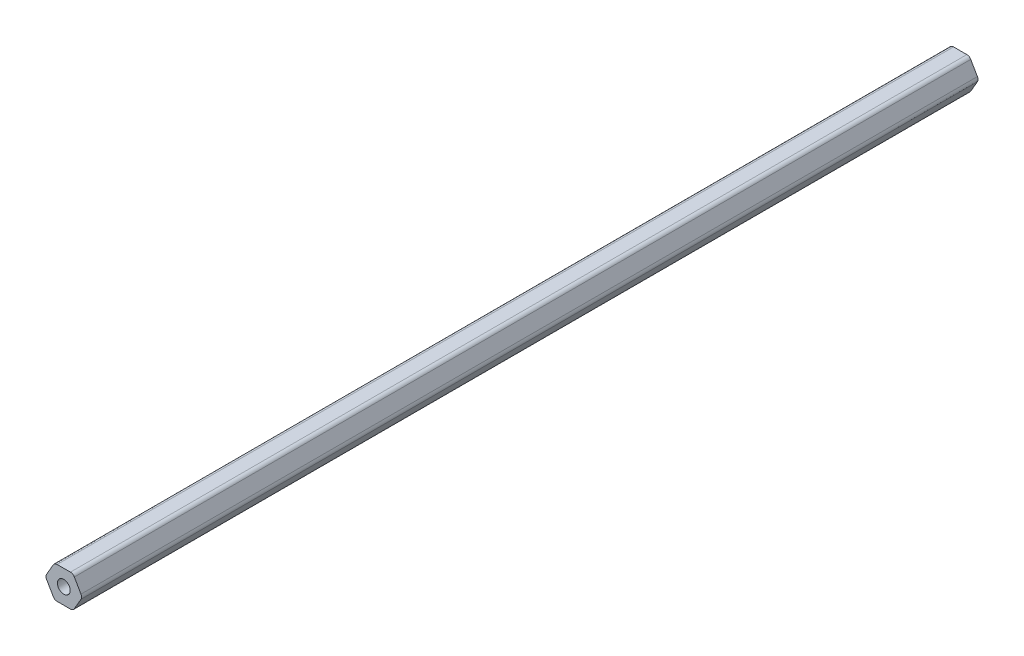
from build123d import *

# Parameters (mm, degrees)
SKETCH1_R           = 2.54
BOSS_EXTRUDE1_DEPTH = 355.6
FILLET1_R           = 1.778


with BuildPart() as part:
    # Sketch1 → Boss-Extrude1 (new body)
    with BuildSketch(Plane.XY):
        Polygon((5.605016339, 0.370142588), (1.93884213, 6.720142588), (-5.393506289, 6.720142588), (-9.059680498, 0.370142588), (-5.393506289, -5.979857412), (1.93884213, -5.979857412), align=None)
        with Locations((-1.727332079, 0.370142588)):
            Circle(SKETCH1_R, mode=Mode.SUBTRACT)
    extrude(amount=BOSS_EXTRUDE1_DEPTH)

    # Fillet1
    fillet1_edges = [part.edges().sort_by_distance(p)[0] for p in [
        (1.93884213, -5.979857412, 177.8),
        (-5.393506289, -5.979857412, 177.8),
        (-9.059680498, 0.370142588, 177.8),
        (-5.393506289, 6.720142588, 177.8),
        (1.93884213, 6.720142588, 177.8),
        (5.605016339, 0.370142588, 177.8),
    ]]
    fillet(fillet1_edges, radius=FILLET1_R)


solid = part.part
